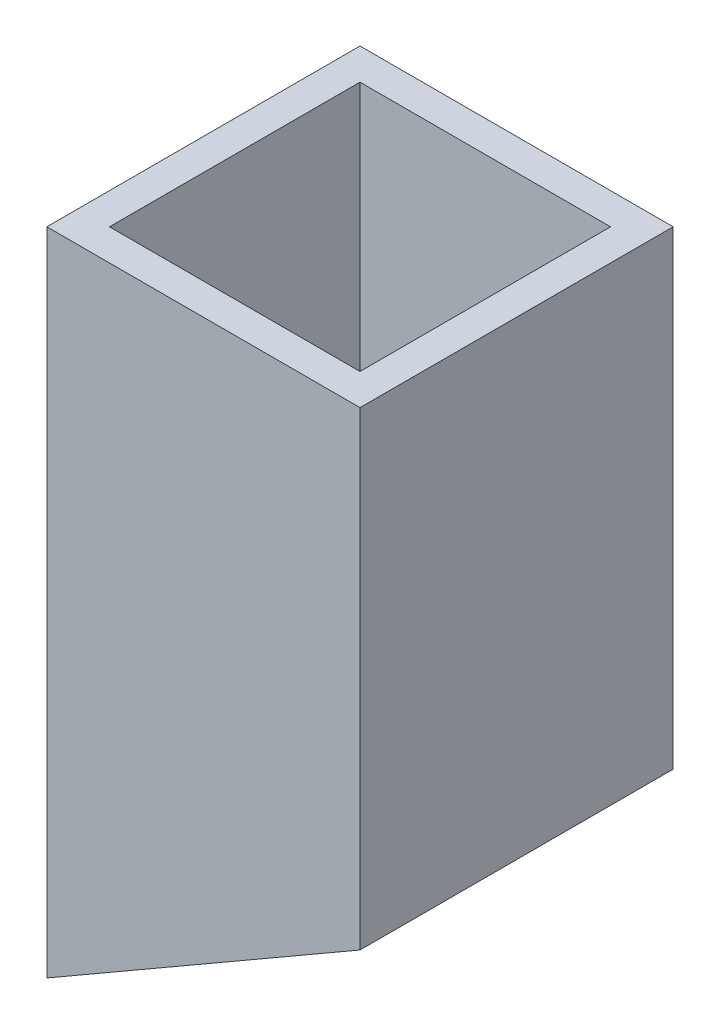
from build123d import *

# Parameters (mm, degrees)
CROQUIS1_W              = 100
CROQUIS1_H              = 100
SALIENTE_EXTRUIR1_DEPTH = 150
SALIENTE_EXTRUIR2_DEPTH = 100
VACIADO4_T              = -10


with BuildPart() as part:
    # Croquis1 → Saliente-Extruir1 (new body)
    with BuildSketch(Plane(origin=(0, 0, 0), x_dir=(1, 0, 0), z_dir=(0, 1, 0))):
        with Locations((50, 50)):
            Rectangle(CROQUIS1_W, CROQUIS1_H)
    extrude(amount=SALIENTE_EXTRUIR1_DEPTH)

    # Croquis2 → Saliente-Extruir2 (add)
    with BuildSketch(Plane.XY):
        Polygon((0, 0), (0, -57.735026919), (100, 0), align=None)
    extrude(amount=-SALIENTE_EXTRUIR2_DEPTH)

    # Vaciado4
    vaciado4_openings = [part.faces().sort_by_distance(p)[0] for p in [
        (50, 150, -50),
    ]]
    offset(amount=VACIADO4_T, openings=vaciado4_openings, kind=Kind.INTERSECTION)


solid = part.part
